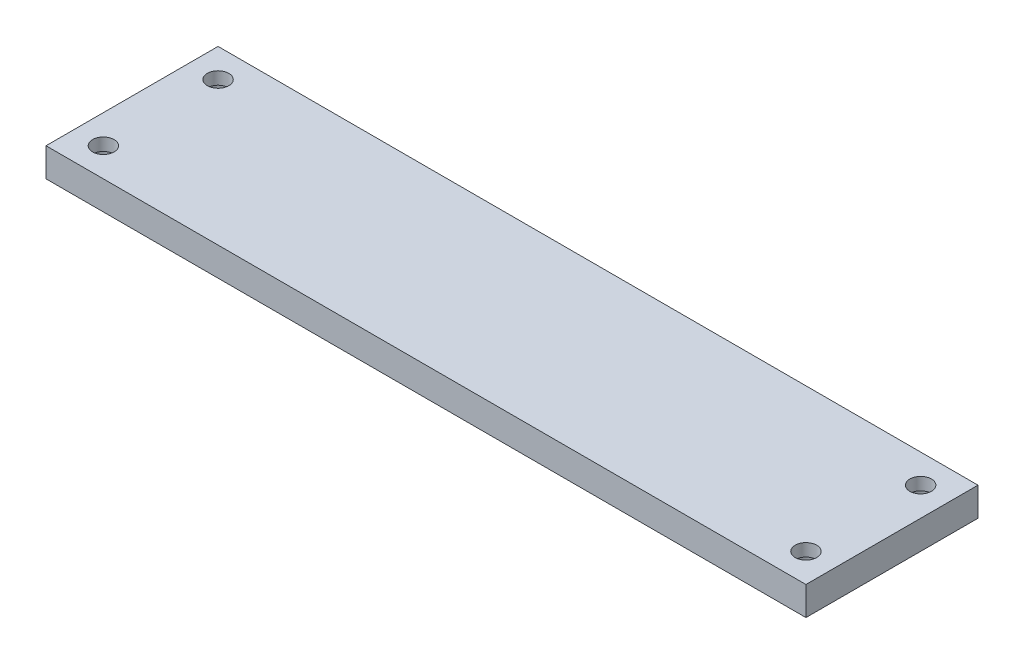
from build123d import *

# Parameters (mm, degrees)
CROQUIS1_W              = 108
CROQUIS1_H              = 26
SALIENTE_EXTRUIR2_DEPTH = 2
CROQUIS3_R              = 1.5
CORTAR_EXTRUIR3_DEPTH   = 10
CROQUIS5_W              = 108
CROQUIS5_H              = 26
CROQUIS5_R              = 1.5
SALIENTE_EXTRUIR4_DEPTH = 2
CROQUIS6_R              = 2.5
CORTAR_EXTRUIR4_DEPTH   = 2.25
CROQUIS7_W              = 108
CROQUIS7_H              = 26
CROQUIS7_W_2            = 106
CROQUIS7_H_2            = 24
CORTAR_EXTRUIR5_DEPTH   = 19


with BuildPart() as part:
    # Croquis1 → Saliente-Extruir2 (new body)
    with BuildSketch(Plane(origin=(0, 0, 0), x_dir=(1, 0, 0), z_dir=(0, 1, 0))):
        Rectangle(CROQUIS1_W, CROQUIS1_H)
    extrude(amount=SALIENTE_EXTRUIR2_DEPTH)

    # Croquis3 → Cortar-Extruir3 (cut)
    with BuildSketch(Plane(origin=(0, 2, 0), x_dir=(1, 0, 0), z_dir=(0, 1, 0))):
        with Locations(Location((-49, 8, 0), (0, 0, 270))):
            Circle(CROQUIS3_R)
        with Locations(Location((-49, -8, 0), (0, 0, 270))):
            Circle(CROQUIS3_R)
        with Locations(Location((49, -8, 0), (0, 0, 270))):
            Circle(CROQUIS3_R)
        with Locations(Location((49, 8, 0), (0, 0, 270))):
            Circle(CROQUIS3_R)
    extrude(amount=-CORTAR_EXTRUIR3_DEPTH, mode=Mode.SUBTRACT)

    # Croquis5 → Saliente-Extruir4 (add)
    with BuildSketch(Plane.XZ):
        Rectangle(CROQUIS5_W, CROQUIS5_H)
        with Locations(Location((-49, -8, 0), (0, 0, 90))):
            Circle(CROQUIS5_R, mode=Mode.SUBTRACT)
        with Locations(Location((-49, 8, 0), (0, 0, 90))):
            Circle(CROQUIS5_R, mode=Mode.SUBTRACT)
        with Locations(Location((49, 8, 0), (0, 0, 90))):
            Circle(CROQUIS5_R, mode=Mode.SUBTRACT)
        with Locations(Location((49, -8, 0), (0, 0, 90))):
            Circle(CROQUIS5_R, mode=Mode.SUBTRACT)
    extrude(amount=SALIENTE_EXTRUIR4_DEPTH)

    # Croquis6 → Cortar-Extruir4 (cut)
    with BuildSketch(Plane.XZ.offset(2)):
        with Locations(Location((-49, -8, 0), (0, 0, 270))):
            Circle(CROQUIS6_R)
        with Locations(Location((-49, 8, 0), (0, 0, 270))):
            Circle(CROQUIS6_R)
        with Locations(Location((49, -8, 0), (0, 0, 270))):
            Circle(CROQUIS6_R)
        with Locations(Location((49, 8, 0), (0, 0, 270))):
            Circle(CROQUIS6_R)
    extrude(amount=-CORTAR_EXTRUIR4_DEPTH, mode=Mode.SUBTRACT)

    # Croquis7 → Cortar-Extruir5 (cut)
    with BuildSketch(Plane.XZ.offset(2)):
        Rectangle(CROQUIS7_W, CROQUIS7_H)
        Rectangle(CROQUIS7_W_2, CROQUIS7_H_2, mode=Mode.SUBTRACT)
    extrude(amount=-CORTAR_EXTRUIR5_DEPTH, mode=Mode.SUBTRACT)


solid = part.part
